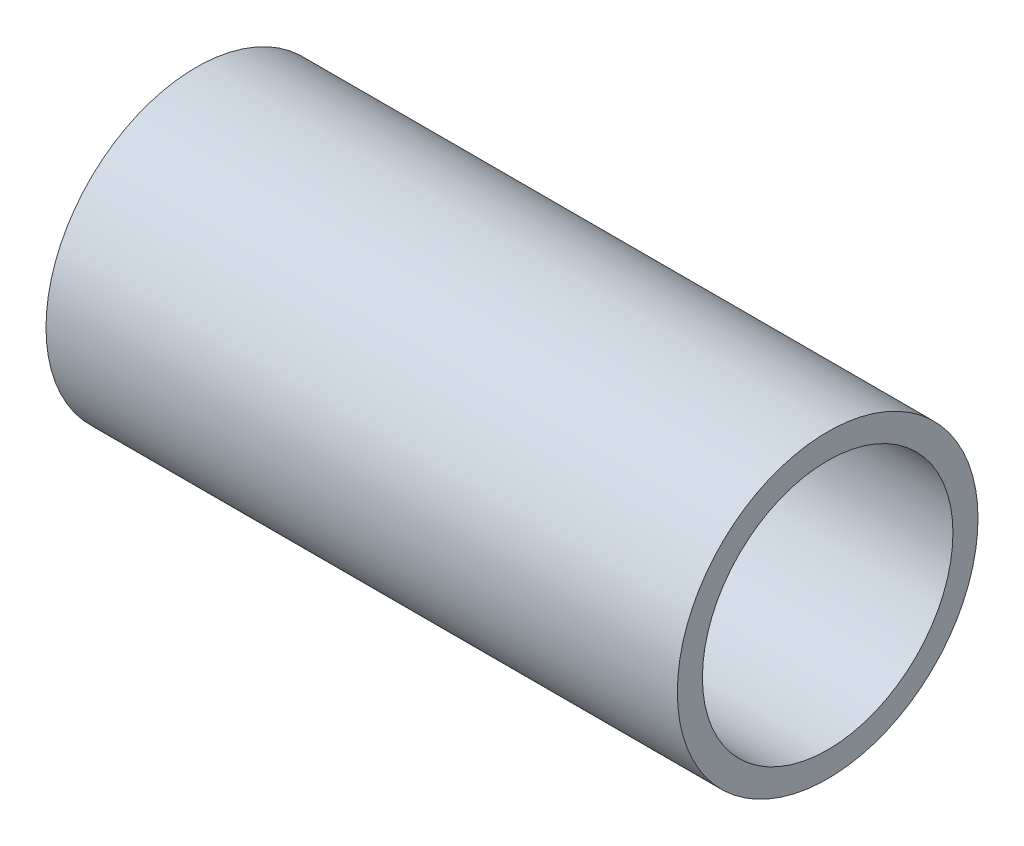
from build123d import *

# Parameters (mm, degrees)
SKETCH1_R           = 15
SKETCH1_R_2         = 12.5
BOSS_EXTRUDE1_DEPTH = 63


with BuildPart() as part:
    # Sketch1 → Boss-Extrude1 (new body)
    with BuildSketch(Plane(origin=(0, 0, 0), x_dir=(0, 0, -1), z_dir=(1, 0, 0))):
        Circle(SKETCH1_R)
        Circle(SKETCH1_R_2, mode=Mode.SUBTRACT)
    extrude(amount=BOSS_EXTRUDE1_DEPTH)


solid = part.part
